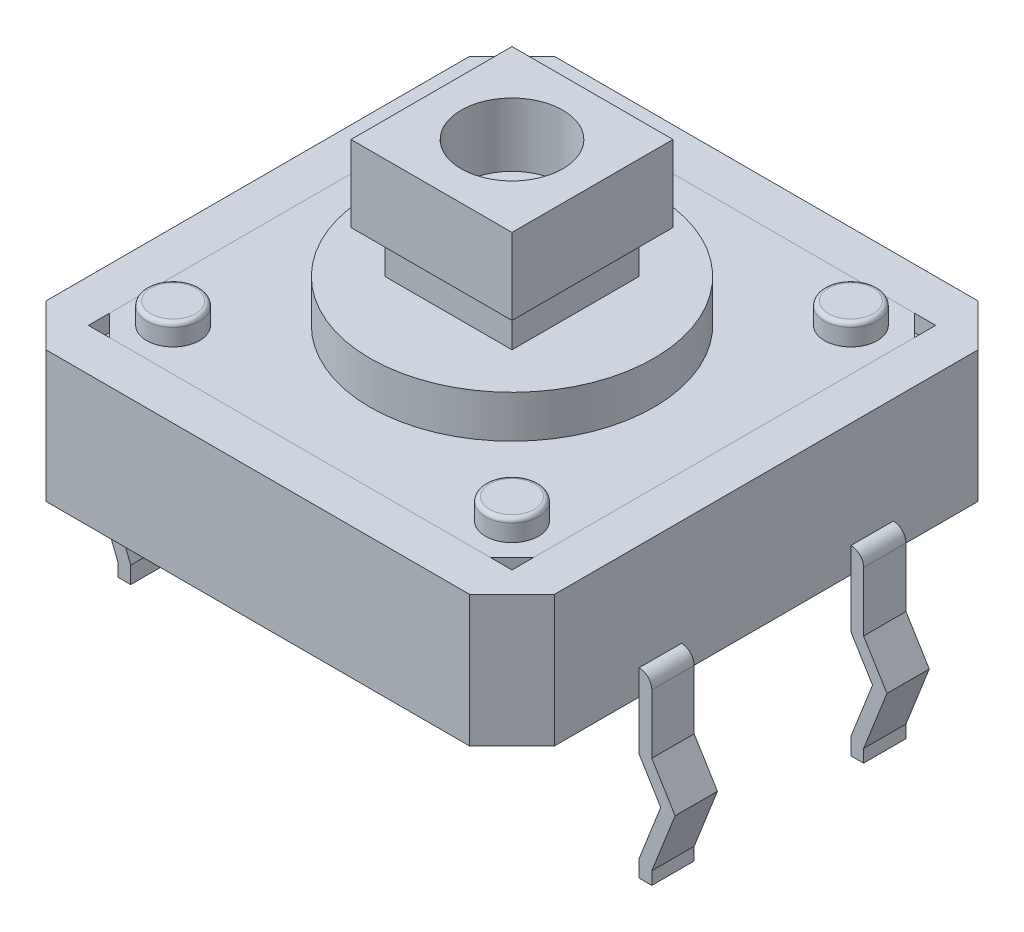
from build123d import *

# Parameters (mm, degrees)
BOSS_EXTRUDE1_DEPTH        = 3.1
SKETCH2_W                  = 10
SKETCH2_H                  = 10
CUT_EXTRUDE1_DEPTH         = 0.4
SKETCH3_R                  = 0.625
BOSS_EXTRUDE2_DEPTH        = 0.9
FILLET1_R                  = 0.1
SKETCH4_R                  = 3.35
BOSS_EXTRUDE3_DEPTH        = 0.4
BOSS_EXTRUDE4_DEPTH        = 3
BOSS_EXTRUDE4_DEPTH_BACK   = 3
BOSS_EXTRUDE4_2_DEPTH      = 3
BOSS_EXTRUDE4_2_DEPTH_BACK = 3
CUT_EXTRUDE2_DEPTH         = 10.829165784
CUT_EXTRUDE2_DEPTH_BACK    = 10.829165784
SKETCH6_W                  = 0.85
SKETCH6_H                  = 4
SKETCH7_R                  = 3.35
BOSS_EXTRUDE5_DEPTH        = 1.4
SKETCH8_W                  = 3
SKETCH8_H                  = 3
BOSS_EXTRUDE6_DEPTH        = 1
SKETCH9_W                  = 3.8
SKETCH9_H                  = 3.8
BOSS_EXTRUDE7_DEPTH        = 1.8
SKETCH11_R                 = 1.2
CUT_EXTRUDE3_DEPTH         = 1.5
BOSS_EXTRUDE8_DEPTH        = 0.2


with BuildPart() as part:
    # Sketch1 → Boss-Extrude1 (new body)
    with BuildSketch(Plane(origin=(0, 0, 0), x_dir=(1, 0, 0), z_dir=(0, 1, 0))):
        Polygon((-5, 6), (-6, 5), (-6, -5), (-5, -6), (5, -6), (6, -5), (6, 5), (5, 6), align=None)
    extrude(amount=BOSS_EXTRUDE1_DEPTH)

    # Sketch2 → Cut-Extrude1 (cut)
    with BuildSketch(Plane(origin=(0, 3.1, 0), x_dir=(1, 0, 0), z_dir=(0, 1, 0))):
        Rectangle(SKETCH2_W, SKETCH2_H)
    extrude(amount=-CUT_EXTRUDE1_DEPTH, mode=Mode.SUBTRACT)

    # Sketch3 → Boss-Extrude2 (add)
    with BuildSketch(Plane(origin=(0, 2.7, 0), x_dir=(1, 0, 0), z_dir=(0, 1, 0))):
        with Locations(Location((-4, 4, 0), (0, 0, 270))):
            Circle(SKETCH3_R)
        with Locations(Location((4, 4, 0), (0, 0, 270))):
            Circle(SKETCH3_R)
        with Locations(Location((-4, -4, 0), (0, 0, 270))):
            Circle(SKETCH3_R)
        with Locations(Location((4, -4, 0), (0, 0, 270))):
            Circle(SKETCH3_R)
    extrude(amount=BOSS_EXTRUDE2_DEPTH)

    # Fillet1
    fillet1_edges = [part.edges().sort_by_distance(p)[0] for p in [
        (-4, 3.6, -4.625),
        (4, 3.6, -4.625),
        (-4, 3.6, 3.375),
        (4, 3.6, 3.375),
    ]]
    fillet(fillet1_edges, radius=FILLET1_R)

    # Sketch12 → Boss-Extrude8 (add)
    with BuildSketch(Plane.XZ):
        Polygon((3, 5.5), (3, 3.7), (5.5, 3.7), (5.5, 4.792893219), (4.792893219, 5.5), align=None)
        Polygon((4.792893219, -5.5), (5.5, -4.792893219), (5.5, -3.7), (3, -3.7), (3, -5.5), align=None)
        Polygon((-3, -5.5), (-3, -3.7), (-5.5, -3.7), (-5.5, -4.792893219), (-4.792893219, -5.5), align=None)
        Polygon((-4.792893219, 5.5), (-5.5, 4.792893219), (-5.5, 3.7), (-3, 3.7), (-3, 5.5), align=None)
    extrude(amount=BOSS_EXTRUDE8_DEPTH)


with BuildPart() as body_2:
    # Sketch4 → Boss-Extrude3 (new body)
    with BuildSketch(Plane(origin=(0, 2.7, 0), x_dir=(1, 0, 0), z_dir=(0, 1, 0))):
        Polygon((4.5, -5), (-4.5, -5), (-5, -4.5), (-5, 4.5), (-4.5, 5), (4.5, 5), (5, 4.5), (5, -4.5), align=None)
        with Locations(Location((0, 0, 0), (0, 0, 270))):
            Circle(SKETCH4_R, mode=Mode.SUBTRACT)
    extrude(amount=BOSS_EXTRUDE3_DEPTH)


with BuildPart() as body_3:
    # Sketch5 → Boss-Extrude4 (new, two sides: drawn at the far end of the back side and taken through both)
    with BuildSketch(Plane.XY.offset(-BOSS_EXTRUDE4_DEPTH_BACK)):
        with BuildLine():
            Line((6, 0.6), (6, -1.164285714))
            Line((6, -1.164285714), (6.510714286, -2))
            Line((6.510714286, -2), (6, -3.3))
            Line((6, -3.3), (6, -3.7))
            Line((6, -3.7), (6.3, -3.7))
            Line((6.3, -3.7), (6.3, -3.4))
            Line((6.3, -3.4), (6.85, -2))
            Line((6.85, -2), (6.3, -1.1))
            Line((6.3, -1.1), (6.3, 0.3))
            ThreePointArc((6.3, 0.3), (6.212132034, 0.512132034), (6, 0.6))
        make_face()
    extrude(amount=BOSS_EXTRUDE4_DEPTH + BOSS_EXTRUDE4_DEPTH_BACK)


with BuildPart() as body_4:
    # Sketch5 → Boss-Extrude4 2 (new, two sides: drawn at the far end of the back side and taken through both)
    with BuildSketch(Plane.XY.offset(-BOSS_EXTRUDE4_2_DEPTH_BACK)):
        with BuildLine():
            Line((-6.510714286, -2), (-6, -3.3))
            Line((-6, -3.3), (-6, -3.7))
            Line((-6, -3.7), (-6.3, -3.7))
            Line((-6.3, -3.7), (-6.3, -3.4))
            Line((-6.3, -3.4), (-6.85, -2))
            Line((-6.85, -2), (-6.3, -1.1))
            Line((-6.3, -1.1), (-6.3, 0.3))
            ThreePointArc((-6.3, 0.3), (-6.212132034, 0.512132034), (-6, 0.6))
            Line((-6, 0.6), (-6, -1.164285714))
            Line((-6, -1.164285714), (-6.510714286, -2))
        make_face()
    extrude(amount=BOSS_EXTRUDE4_2_DEPTH + BOSS_EXTRUDE4_2_DEPTH_BACK)


with BuildPart() as cut_extrude2_tool:
    # Sketch6 → Cut-Extrude2 (new, two sides: drawn at the far end of the back side and taken through both)
    with BuildSketch(Plane(origin=(0, 0, 0), x_dir=(1, 0, 0), z_dir=(0, 1, 0)).offset(-CUT_EXTRUDE2_DEPTH_BACK)):
        with Locations((-6.425, 0)):
            Rectangle(SKETCH6_W, SKETCH6_H)
        with Locations((6.425, 0)):
            Rectangle(SKETCH6_W, SKETCH6_H)
    extrude(amount=CUT_EXTRUDE2_DEPTH + CUT_EXTRUDE2_DEPTH_BACK)


with BuildPart() as body_3_1:
    add(body_3.part)

    # Cut-Extrude2: cut by cut_extrude2_tool
    add(cut_extrude2_tool.part, mode=Mode.SUBTRACT)


with BuildPart() as body_4_1:
    add(body_4.part)

    # Cut-Extrude2: cut by cut_extrude2_tool
    add(cut_extrude2_tool.part, mode=Mode.SUBTRACT)


with BuildPart() as cut_extrude2_piece_1:
    # of the separate pieces the step leaves, piece 1, a body of its own (cut_extrude2_pieces)
    add(body_3_1.part.solids().sort_by_distance((6, 0.6, -2))[0])


with BuildPart() as cut_extrude2_piece_2:
    # of the separate pieces the step leaves, piece 2, a body of its own (cut_extrude2_pieces)
    add(body_3_1.part.solids().sort_by_distance((6, 0.6, 3))[0])


with BuildPart() as cut_extrude2_piece_1_of_body_4:
    # of the separate pieces the step leaves, piece 1, a body of its own (cut_extrude2_pieces_of_body_4)
    add(body_4_1.part.solids().sort_by_distance((-6.510714286, -2, -3))[0])


with BuildPart() as cut_extrude2_piece_2_of_body_4:
    # of the separate pieces the step leaves, piece 2, a body of its own (cut_extrude2_pieces_of_body_4)
    add(body_4_1.part.solids().sort_by_distance((-6.510714286, -2, 2))[0])


with BuildPart() as body_7:
    # Sketch7 → Boss-Extrude5 (new body)
    with BuildSketch(Plane(origin=(0, 2.7, 0), x_dir=(1, 0, 0), z_dir=(0, 1, 0))):
        with Locations(Location((0, 0, 0), (0, 0, 270))):
            Circle(SKETCH7_R)
    extrude(amount=BOSS_EXTRUDE5_DEPTH)

    # Sketch8 → Boss-Extrude6 (add)
    with BuildSketch(Plane(origin=(0, 4.1, 0), x_dir=(1, 0, 0), z_dir=(0, 1, 0))):
        Rectangle(SKETCH8_W, SKETCH8_H)
    extrude(amount=BOSS_EXTRUDE6_DEPTH)

    # Sketch9 → Boss-Extrude7 (add)
    with BuildSketch(Plane(origin=(0, 5.1, 0), x_dir=(1, 0, 0), z_dir=(0, 1, 0))):
        Rectangle(SKETCH9_W, SKETCH9_H)
    extrude(amount=BOSS_EXTRUDE7_DEPTH)

    # Sketch11 → Cut-Extrude3 (cut)
    with BuildSketch(Plane(origin=(0, 6.9, 0), x_dir=(1, 0, 0), z_dir=(0, 1, 0))):
        with Locations(Location((0, 0, 0), (0, 0, 270))):
            Circle(SKETCH11_R)
    extrude(amount=-CUT_EXTRUDE3_DEPTH, mode=Mode.SUBTRACT)


solid = Compound([part.part, body_2.part, cut_extrude2_piece_1.part, cut_extrude2_piece_2.part, cut_extrude2_piece_1_of_body_4.part, cut_extrude2_piece_2_of_body_4.part, body_7.part])
